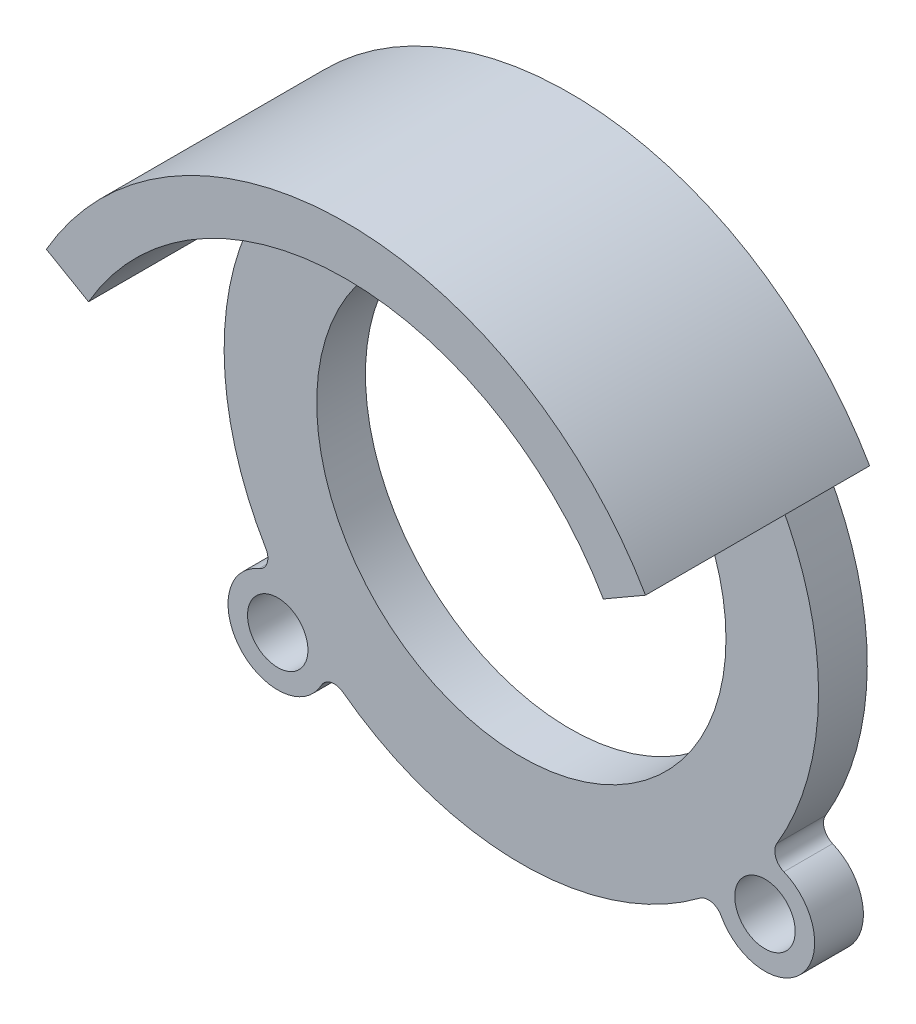
from build123d import *

# Parameters (mm, degrees)
ESBO_O1_R                = 21
ESBO_O1_R_2              = 3.1
RESSALTO_EXTRUS_O1_DEPTH = 5
RESSALTO_EXTRUS_O2_DEPTH = 18


with BuildPart() as part:
    # Esboço1 → Ressalto-extrusão1 (new body)
    with BuildSketch(Plane.XY):
        with BuildLine():
            Line((-26.413774815, 15.25), (-30.743901834, 17.75))
            ThreePointArc((-30.743901834, 17.75), (0, 35.5), (30.743901834, 17.75))
            Line((30.743901834, 17.75), (26.413774815, 15.25))
            ThreePointArc((26.413774815, 15.25), (30.49940407, -0.19066032), (26.22105388, -15.579035061))
            ThreePointArc((26.22105388, -15.579035061), (26.087819075, -16.82024855), (26.940019837, -17.73245264))
            ThreePointArc((26.940019837, -17.73245264), (28.794642857, -25.856499042), (20.518582449, -24.883575301))
            ThreePointArc((20.518582449, -24.883575301), (19.520268693, -24.134087419), (18.30049416, -24.399629372))
            ThreePointArc((18.30049416, -24.399629372), (0, -30.5), (-18.30049416, -24.399629372))
            ThreePointArc((-18.30049416, -24.399629372), (-19.520268693, -24.134087419), (-20.518582449, -24.883575301))
            ThreePointArc((-20.518582449, -24.883575301), (-28.794642857, -25.856499042), (-26.940019837, -17.73245264))
            ThreePointArc((-26.940019837, -17.73245264), (-26.087819075, -16.82024855), (-26.22105388, -15.579035061))
            ThreePointArc((-26.22105388, -15.579035061), (-30.49940407, -0.19066032), (-26.413774815, 15.25))
        make_face()
        Circle(ESBO_O1_R, mode=Mode.SUBTRACT)
        with Locations((25, -22.449053432)):
            Circle(ESBO_O1_R_2, mode=Mode.SUBTRACT)
        with Locations((-25, -22.449053432)):
            Circle(ESBO_O1_R_2, mode=Mode.SUBTRACT)
    extrude(amount=RESSALTO_EXTRUS_O1_DEPTH)

    # Esboço2 → Ressalto-extrusão2 (add)
    with BuildSketch(Plane.XY.offset(5)):
        with BuildLine():
            Line((-26.413774815, 15.25), (-30.743901834, 17.75))
            ThreePointArc((-30.743901834, 17.75), (0, 35.5), (30.743901834, 17.75))
            Line((30.743901834, 17.75), (26.413774815, 15.25))
            ThreePointArc((26.413774815, 15.25), (0, 30.5), (-26.413774815, 15.25))
        make_face()
    extrude(amount=RESSALTO_EXTRUS_O2_DEPTH)


solid = part.part
